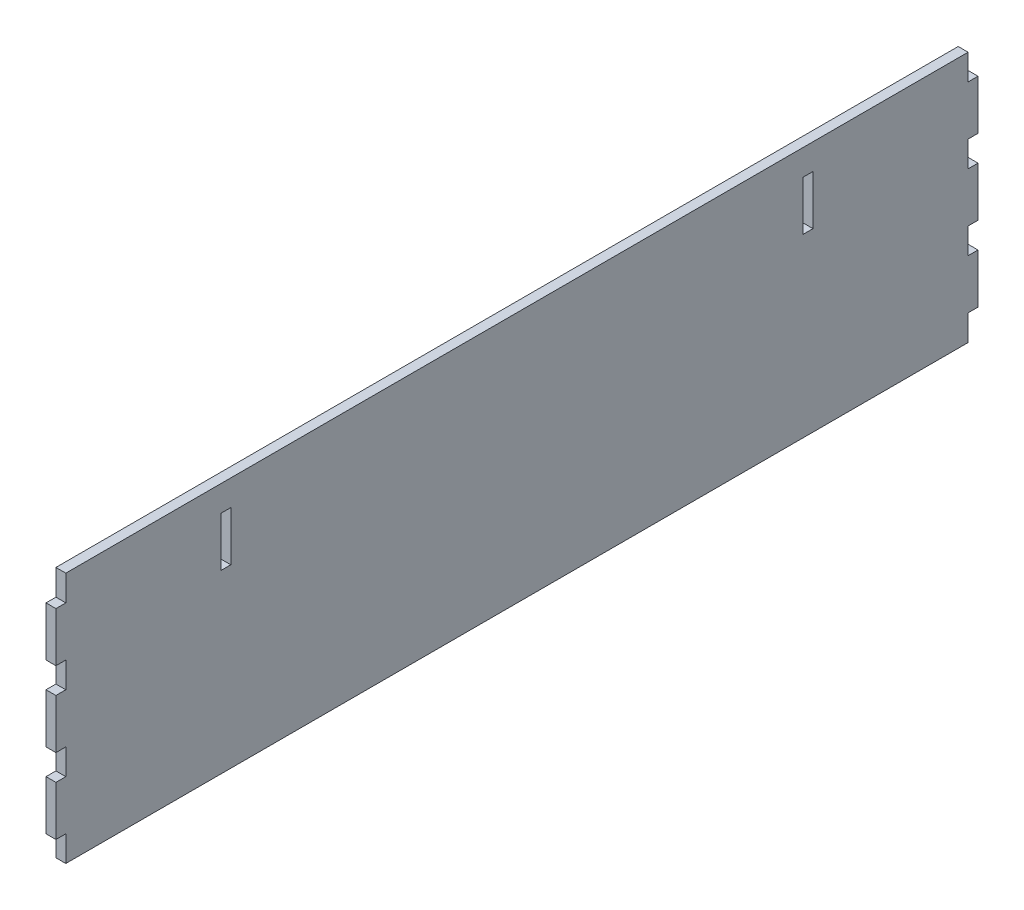
from build123d import *

# Parameters (mm, degrees)
SKETCH1_W               = 279.4
SKETCH1_H               = 76.2
BOSS_EXTRUDE1_DEPTH     = 3
SKETCH3_W               = 3
SKETCH3_H               = 7.8
CUT_EXTRUDE1_DEPTH      = 145.833352512
LPATTERN1_COUNT         = 4
LPATTERN1_PITCH         = 22.8
MIRROR1_COPY_1_SKETCH_W = 3
MIRROR1_COPY_1_SKETCH_H = 7.8
MIRROR1_COPY_1_DEPTH    = 145.833352512
MIRROR1_COPY_2_SKETCH_W = 3
MIRROR1_COPY_2_SKETCH_H = 7.8
MIRROR1_COPY_2_DEPTH    = 145.833352512
MIRROR1_COPY_3_SKETCH_W = 3
MIRROR1_COPY_3_SKETCH_H = 7.8
MIRROR1_COPY_3_DEPTH    = 145.833352512
SKETCH5_W               = 3
SKETCH5_H               = 15
CUT_EXTRUDE3_DEPTH      = 10


with BuildPart() as part:
    # Sketch1 → Boss-Extrude1 (new body)
    with BuildSketch(Plane(origin=(0, 0, 0), x_dir=(0, 0, -1), z_dir=(1, 0, 0))):
        Rectangle(SKETCH1_W, SKETCH1_H)
    extrude(amount=-BOSS_EXTRUDE1_DEPTH)

    # Sketch3 → Cut-Extrude1 (cut, through all)
    with BuildSketch(Plane.ZY.offset(3)):
        with Locations((-138.2, 34.2)):
            Rectangle(SKETCH3_W, SKETCH3_H)
    cut_extrude1 = extrude(amount=-CUT_EXTRUDE1_DEPTH, mode=Mode.SUBTRACT)

    # LPattern1: Cut-Extrude1 ×4
    with Locations(*[(0, -i * LPATTERN1_PITCH, 0) for i in range(1, LPATTERN1_COUNT)]):
        add(cut_extrude1, mode=Mode.SUBTRACT)

    # Mirror1: Cut-Extrude1 across plane
    add(cut_extrude1.mirror(Plane.XY), mode=Mode.SUBTRACT)

    # Mirror1 copy 1 sketch → Mirror1 copy 1 (cut, through all)
    with BuildSketch(Plane(origin=(-3, -22.8, 0), x_dir=(0, 0, -1), z_dir=(-1, 0, 0))):
        with Locations((-138.2, -34.2)):
            Rectangle(MIRROR1_COPY_1_SKETCH_W, MIRROR1_COPY_1_SKETCH_H)
    extrude(amount=-MIRROR1_COPY_1_DEPTH, mode=Mode.SUBTRACT)

    # Mirror1 copy 2 sketch → Mirror1 copy 2 (cut, through all)
    with BuildSketch(Plane(origin=(-3, -45.6, 0), x_dir=(0, 0, -1), z_dir=(-1, 0, 0))):
        with Locations((-138.2, -34.2)):
            Rectangle(MIRROR1_COPY_2_SKETCH_W, MIRROR1_COPY_2_SKETCH_H)
    extrude(amount=-MIRROR1_COPY_2_DEPTH, mode=Mode.SUBTRACT)

    # Mirror1 copy 3 sketch → Mirror1 copy 3 (cut, through all)
    with BuildSketch(Plane(origin=(-3, -68.4, 0), x_dir=(0, 0, -1), z_dir=(-1, 0, 0))):
        with Locations((-138.2, -34.2)):
            Rectangle(MIRROR1_COPY_3_SKETCH_W, MIRROR1_COPY_3_SKETCH_H)
    extrude(amount=-MIRROR1_COPY_3_DEPTH, mode=Mode.SUBTRACT)

    # Sketch5 → Cut-Extrude3 (cut)
    with BuildSketch(Plane.ZY.offset(3)):
        with Locations((-88.2, 22.8)):
            Rectangle(SKETCH5_W, SKETCH5_H)
    cut_extrude3 = extrude(amount=-CUT_EXTRUDE3_DEPTH, mode=Mode.SUBTRACT)

    # Mirror2: Cut-Extrude3 across plane
    add(cut_extrude3.mirror(Plane.XY), mode=Mode.SUBTRACT)


solid = part.part
